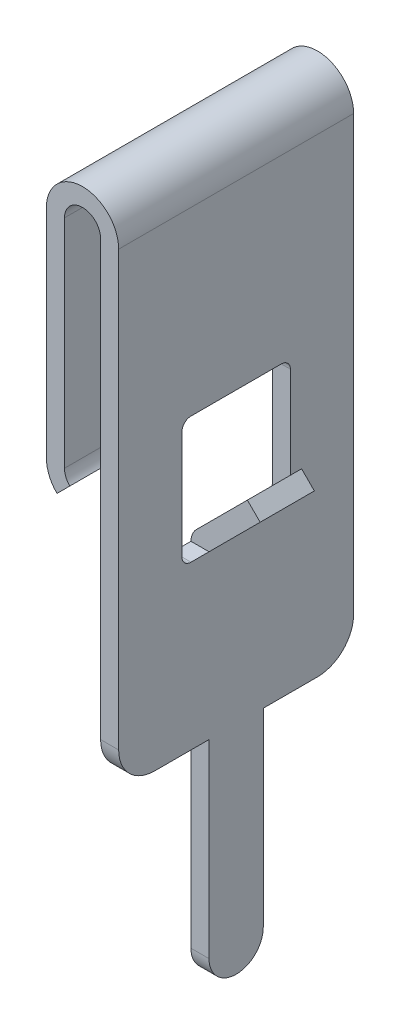
from build123d import *

# Parameters (mm, degrees)
EXTRUDE_1_DEPTH     = 6.5
CUT_EXTRUDE_1_DEPTH = 2
SKETCH_3_W          = 2
SKETCH_3_H          = 2
CUT_EXTRUDE_2_DEPTH = 2.5
SKETCH_4_W          = 2
SKETCH_4_H          = 2
CUT_EXTRUDE_3_DEPTH = 2.5
CUT_EXTRUDE_4_DEPTH = 0.6
SKETCH_6_W          = 1.5
SKETCH_6_H          = 0.707106781
EXTRUDE_2_DEPTH     = 0.5
CUT_EXTRUDE_5_DEPTH = 2
FILLET_1_R          = 0.5


with BuildPart() as part:
    # Эскиз1 → Бобышка-Вытянуть1 (new body)
    with BuildSketch(Plane.XY):
        with BuildLine():
            Line((-2, 19), (-2, 13))
            ThreePointArc((-2, 13), (-1.923879533, 12.617316568), (-1.707106781, 12.292893219))
            Line((-1.707106781, 12.292893219), (-1.353553391, 12.646446609))
            ThreePointArc((-1.353553391, 12.646446609), (-1.461939766, 12.808658284), (-1.5, 13))
            Line((-1.5, 13), (-1.5, 19))
            ThreePointArc((-1.5, 19), (-1, 19.5), (-0.5, 19))
            Line((-0.5, 19), (-0.5, 0))
            Line((-0.5, 0), (0, 0))
            Line((0, 0), (0, 10.5))
            Line((0, 10.5), (1.414213562, 11.914213562))
            Line((1.414213562, 11.914213562), (1.060660172, 12.267766953))
            Line((1.060660172, 12.267766953), (0, 11.207106781))
            Line((0, 11.207106781), (0, 19))
            ThreePointArc((0, 19), (-1, 20), (-2, 19))
        make_face()
    extrude(amount=EXTRUDE_1_DEPTH)

    # Эскиз2 → Вырез-Вытянуть1 (cut)
    with BuildSketch(Plane.ZY.offset(0.5)):
        with BuildLine():
            Line((4, 6), (5.5, 6))
            ThreePointArc((5.5, 6), (6.207106781, 6.292893219), (6.5, 7))
            Line((6.5, 7), (8.5, 7))
            Line((8.5, 7), (8.5, -1))
            Line((8.5, -1), (-2, -1))
            Line((-2, -1), (-2, 7))
            Line((-2, 7), (0, 7))
            ThreePointArc((0, 7), (0.292893219, 6.292893219), (1, 6))
            Line((1, 6), (2.5, 6))
            Line((2.5, 6), (2.5, 0.75))
            ThreePointArc((2.5, 0.75), (3.25, 0), (4, 0.75))
            Line((4, 0.75), (4, 6))
        make_face()
    extrude(amount=-CUT_EXTRUDE_1_DEPTH, mode=Mode.SUBTRACT)

    # Эскиз3 → Вырез-Вытянуть2 (cut)
    with BuildSketch(Plane.XY.offset(6.5)):
        with Locations((1, 11.5)):
            Rectangle(SKETCH_3_W, SKETCH_3_H)
    extrude(amount=-CUT_EXTRUDE_2_DEPTH, mode=Mode.SUBTRACT)

    # Эскиз4 → Вырез-Вытянуть3 (cut)
    with BuildSketch(Plane(origin=(0, 0, 0), x_dir=(-1, 0, 0), z_dir=(0, 0, -1))):
        with Locations((-1, 11.5)):
            Rectangle(SKETCH_4_W, SKETCH_4_H)
    extrude(amount=-CUT_EXTRUDE_3_DEPTH, mode=Mode.SUBTRACT)

    # Эскиз5 → Вырез-Вытянуть4 (cut)
    with BuildSketch(Plane(origin=(0, 0, 0), x_dir=(0, 0, -1), z_dir=(1, 0, 0))):
        with BuildLine():
            Line((-3.25, 10.5), (-2, 10.5))
            ThreePointArc((-2, 10.5), (-1.823223305, 10.573223305), (-1.75, 10.75))
            Line((-1.75, 10.75), (-1.75, 13.75))
            ThreePointArc((-1.75, 13.75), (-1.823223305, 13.926776695), (-2, 14))
            Line((-2, 14), (-4.5, 14))
            ThreePointArc((-4.5, 14), (-4.676776695, 13.926776695), (-4.75, 13.75))
            Line((-4.75, 13.75), (-4.75, 10.75))
            ThreePointArc((-4.75, 10.75), (-4.676776695, 10.573223305), (-4.5, 10.5))
            Line((-4.5, 10.5), (-3.25, 10.5))
        make_face()
    extrude(amount=-CUT_EXTRUDE_4_DEPTH, mode=Mode.SUBTRACT)


with BuildPart() as cut_extrude_4_piece_1:
    # of the separate pieces the step leaves, piece 1, a body of its own (cut_extrude_4_pieces)
    add(part.part.solids().sort_by_distance((-2, 19, 0))[0])



with BuildPart() as cut_extrude_4_piece_2:
    # of the separate pieces the step leaves, piece 2, a body of its own (cut_extrude_4_pieces)
    add(part.part.solids().sort_by_distance((1.414213562, 11.914213562, 2.5))[0])


with BuildPart() as cut_extrude_4_piece_1_1:
    add(cut_extrude_4_piece_1.part)

    add(cut_extrude_4_piece_2.part)  # Бобышка-Вытянуть2 merges Вырез-Вытянуть4 piece 2
    # Эскиз6 → Бобышка-Вытянуть2 (add)
    with BuildSketch(Plane.ZY):
        with Locations((3.25, 10.853553391)):
            Rectangle(SKETCH_6_W, SKETCH_6_H)
    extrude(amount=EXTRUDE_2_DEPTH)

    # Эскиз7 → Вырез-Вытянуть5 (cut)
    with BuildSketch(Plane(origin=(0, 0, 2.5), x_dir=(-1, 0, 0), z_dir=(0, 0, -1))):
        Polygon((0, 11.207106781), (0.5, 10.707106781), (1, 10.707106781), (1, 11.207106781), align=None)
    extrude(amount=-CUT_EXTRUDE_5_DEPTH, mode=Mode.SUBTRACT)

    # Скругление1
    fillet_1_edges = [cut_extrude_4_piece_1_1.edges().sort_by_distance(p)[0] for p in [
        (-0.5, 10.707106781, 3.25),
    ]]
    fillet(fillet_1_edges, radius=FILLET_1_R)


solid = cut_extrude_4_piece_1_1.part
